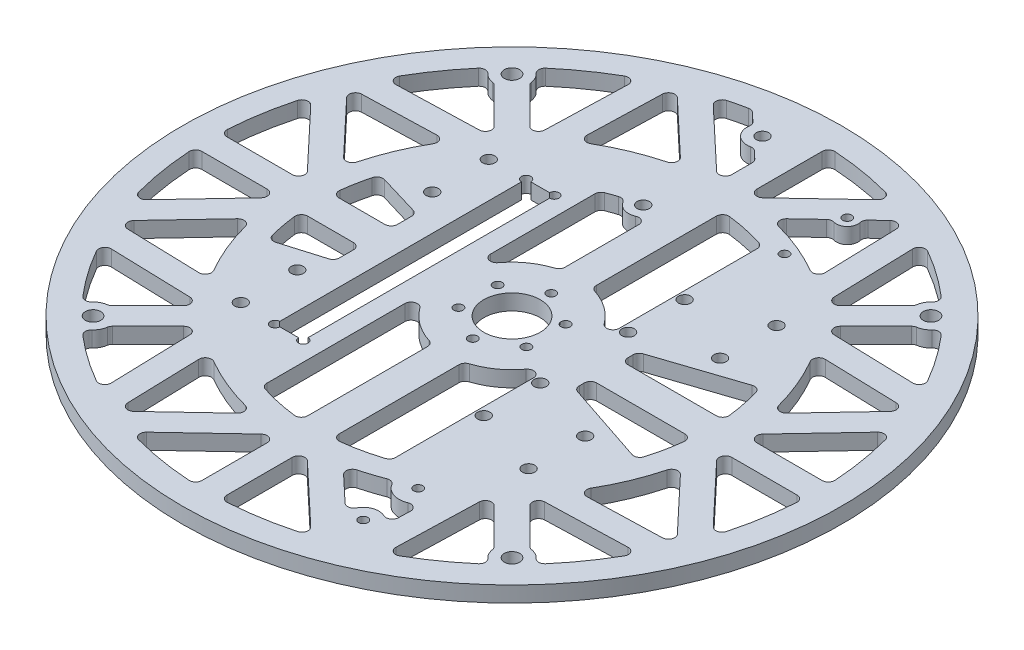
from build123d import *

# Parameters (mm, degrees)
SKETCH_1_R          = 105
EXTRUDE_1_DEPTH     = 5
SKETCH_3_R          = 1.95
SKETCH_3_R_2        = 1.45
CUT_EXTRUDE_1_DEPTH = 149.576579581
SKETCH_6_W          = 9
SKETCH_6_H          = 80
CUT_EXTRUDE_2_DEPTH = 149.576579581
SKETCH_7_R          = 2.45
CUT_EXTRUDE_3_DEPTH = 149.576579581
SKETCH_8_R          = 1.45
CUT_EXTRUDE_4_DEPTH = 149.576579581
SKETCH_10_R         = 9
CUT_EXTRUDE_5_DEPTH = 149.576579581
CUT_EXTRUDE_7_DEPTH = 149.576579581
FILLET_3_R          = 2
SKETCH_11_R         = 1.5
CUT_EXTRUDE_8_DEPTH = 149.576579726


with BuildPart() as part:
    # 草图1 → 凸台-拉伸1 (new body)
    with BuildSketch(Plane(origin=(0, 0, 0), x_dir=(1, 0, 0), z_dir=(0, 1, 0))):
        with Locations(Location((0, 0, 0), (0, 0, 270))):
            Circle(SKETCH_1_R)
    extrude(amount=EXTRUDE_1_DEPTH)

    # 草图3 → 切除-拉伸1 (cut, through all)
    with BuildSketch(Plane(origin=(0, 5, 0), x_dir=(1, 0, 0), z_dir=(0, 1, 0))):
        with Locations(Location((-46.9, -39.5, 0), (0, 0, 270))):
            Circle(SKETCH_3_R)
        with Locations(Location((-46.9, -21.5, 0), (0, 0, 270))):
            Circle(SKETCH_3_R)
        with Locations(Location((-46.9, 21.5, 0), (0, 0, 270))):
            Circle(SKETCH_3_R)
        with Locations(Location((-46.9, 39.5, 0), (0, 0, 270))):
            Circle(SKETCH_3_R)
        with Locations(Location((23, -32, 0), (0, 0, 270))):
            Circle(SKETCH_3_R)
        with Locations(Location((23, -14, 0), (0, 0, 270))):
            Circle(SKETCH_3_R)
        with Locations(Location((44.8, -39.5, 0), (0, 0, 270))):
            Circle(SKETCH_3_R)
        with Locations(Location((44.8, -21.5, 0), (0, 0, 270))):
            Circle(SKETCH_3_R)
        with Locations(Location((44.8, 39.5, 0), (0, 0, 270))):
            Circle(SKETCH_3_R)
        with Locations(Location((44.8, 21.5, 0), (0, 0, 270))):
            Circle(SKETCH_3_R)
        with Locations(Location((23, 32, 0), (0, 0, 270))):
            Circle(SKETCH_3_R)
        with Locations(Location((23, 14, 0), (0, 0, 270))):
            Circle(SKETCH_3_R)
        with Locations(Location((-9.7, 89.515955641, 0), (0, 0, 270))):
            Circle(SKETCH_3_R)
        with Locations(Location((-9.7, 51.515955641, 0), (0, 0, 270))):
            Circle(SKETCH_3_R)
        with Locations(Location((26.3, 80.515955641, 0), (0, 0, 270))):
            Circle(SKETCH_3_R_2)
        with Locations(Location((32.6, -62.5, 0), (0, 0, 270))):
            Circle(SKETCH_3_R_2)
        with Locations(Location((32.6, -80, 0), (0, 0, 270))):
            Circle(SKETCH_3_R_2)
        with Locations(Location((26.3, 60.515955641, 0), (0, 0, 270))):
            Circle(SKETCH_3_R_2)
    extrude(amount=-CUT_EXTRUDE_1_DEPTH, mode=Mode.SUBTRACT)

    # 草图6 → 切除-拉伸2 (cut, through all)
    with BuildSketch(Plane.XZ):
        with Locations((-31, 0)):
            Rectangle(SKETCH_6_W, SKETCH_6_H)
    extrude(amount=-CUT_EXTRUDE_2_DEPTH, mode=Mode.SUBTRACT)

    # 草图7 → 切除-拉伸3 (cut, through all)
    with BuildSketch(Plane(origin=(0, 5, 0), x_dir=(1, 0, 0), z_dir=(0, 1, 0))):
        with Locations(Location((66.740273542, 66.740273542, 0), (0, 0, 270))):
            Circle(SKETCH_7_R)
        with Locations(Location((-66.740273542, 66.740273542, 0), (0, 0, 270))):
            Circle(SKETCH_7_R)
        with Locations(Location((-66.740273542, -66.740273542, 0), (0, 0, 270))):
            Circle(SKETCH_7_R)
        with Locations(Location((66.740273542, -66.740273542, 0), (0, 0, 270))):
            Circle(SKETCH_7_R)
    extrude(amount=-CUT_EXTRUDE_3_DEPTH, mode=Mode.SUBTRACT)

    # 草图8 → 切除-拉伸4 (cut, through all)
    with BuildSketch(Plane(origin=(0, 5, 0), x_dir=(1, 0, 0), z_dir=(0, 1, 0))):
        with Locations(Location((0, 12.5, 0), (0, 0, 270))):
            Circle(SKETCH_8_R)
        with Locations(Location((10.825317547, 6.25, 0), (0, 0, 270))):
            Circle(SKETCH_8_R)
        with Locations(Location((10.825317547, -6.25, 0), (0, 0, 270))):
            Circle(SKETCH_8_R)
        with Locations(Location((0, -12.5, 0), (0, 0, 270))):
            Circle(SKETCH_8_R)
        with Locations(Location((-10.825317547, -6.25, 0), (0, 0, 270))):
            Circle(SKETCH_8_R)
        with Locations(Location((-10.825317547, 6.25, 0), (0, 0, 270))):
            Circle(SKETCH_8_R)
    extrude(amount=-CUT_EXTRUDE_4_DEPTH, mode=Mode.SUBTRACT)

    # 草图10 → 切除-拉伸5 (cut, through all)
    with BuildSketch(Plane.XZ):
        with Locations(Location((0, 0, 0), (0, 0, 270))):
            Circle(SKETCH_10_R)
    extrude(amount=-CUT_EXTRUDE_5_DEPTH, mode=Mode.SUBTRACT)

    # 草图9 → 切除-拉伸7 (cut, through all)
    with BuildSketch(Plane.XZ):
        with BuildLine():
            Line((-96.917490682, 4), (-69.384796606, 4))
            Line((-69.384796606, 4), (-92.660792351, 28.687585484))
            ThreePointArc((-92.660792351, 28.687585484), (-95.589489844, 16.481790903), (-96.917490682, 4))
        make_face()
        with BuildLine():
            Line((-68.028931884, 14.223727596), (-89.616314654, 37.120292939))
            Line((-89.616314654, 37.120292939), (-58.161413289, 38.046024815))
            ThreePointArc((-58.161413289, 38.046024815), (-64.20962751, 26.596498549), (-68.028931884, 14.223727596))
        make_face()
        with BuildLine():
            Line((-85.806260853, 45.23588839), (-51.890887316, 46.234033066))
            Line((-51.890887316, 46.234033066), (-66.951211412, 61.294357163))
            ThreePointArc((-66.951211412, 61.294357163), (-70.037232101, 62.400623296), (-71.930303966, 65.077118647))
            ThreePointArc((-71.930303966, 65.077118647), (-79.489776542, 55.591145205), (-85.806260853, 45.23588839))
        make_face()
        with BuildLine():
            Line((-28.687585484, 92.660792351), (-4, 69.384796606))
            Line((-4, 69.384796606), (-4, 96.917490682))
            ThreePointArc((-4, 96.917490682), (-16.481790903, 95.589489844), (-28.687585484, 92.660792351))
        make_face()
        with BuildLine():
            Line((-38.046024815, 58.161413289), (-37.120292939, 89.616314654))
            Line((-37.120292939, 89.616314654), (-14.223727596, 68.028931884))
            ThreePointArc((-14.223727596, 68.028931884), (-26.596498549, 64.20962751), (-38.046024815, 58.161413289))
        make_face()
        with BuildLine():
            Line((-61.294357163, 66.951211412), (-46.234033066, 51.890887316))
            Line((-46.234033066, 51.890887316), (-45.23588839, 85.806260853))
            ThreePointArc((-45.23588839, 85.806260853), (-55.591145205, 79.489776542), (-65.077118647, 71.930303966))
            ThreePointArc((-65.077118647, 71.930303966), (-62.400623296, 70.037232101), (-61.294357163, 66.951211412))
        make_face()
        with BuildLine():
            Line((45.23588839, 85.806260853), (46.234033066, 51.890887316))
            Line((46.234033066, 51.890887316), (61.294357163, 66.951211412))
            ThreePointArc((61.294357163, 66.951211412), (62.400623296, 70.037232101), (65.077118647, 71.930303966))
            ThreePointArc((65.077118647, 71.930303966), (55.591145205, 79.489776542), (45.23588839, 85.806260853))
        make_face()
        with BuildLine():
            Line((14.223727596, 68.028931884), (27.705618691, 80.739953784))
            ThreePointArc((27.705618691, 80.739953784), (31.698178556, 75.132842916), (37.434581063, 78.937302516))
            Line((37.434581063, 78.937302516), (37.825729314, 65.646705124))
            ThreePointArc((37.825729314, 65.646705124), (31.787163111, 68.545601392), (26.728717013, 64.154701206))
            ThreePointArc((26.728717013, 64.154701206), (20.56764682, 66.38691064), (14.223727596, 68.028931884))
        make_face()
        with BuildLine():
            Line((4, 96.917490682), (4, 69.384796606))
            Line((4, 69.384796606), (28.687585484, 92.660792351))
            ThreePointArc((28.687585484, 92.660792351), (16.481790903, 95.589489844), (4, 96.917490682))
        make_face()
        with BuildLine():
            Line((92.660792351, 28.687585484), (69.384796606, 4))
            Line((69.384796606, 4), (96.917490682, 4))
            ThreePointArc((96.917490682, 4), (95.589489844, 16.481790903), (92.660792351, 28.687585484))
        make_face()
        with BuildLine():
            Line((58.161413289, 38.046024815), (89.616314654, 37.120292939))
            Line((89.616314654, 37.120292939), (68.028931884, 14.223727596))
            ThreePointArc((68.028931884, 14.223727596), (64.20962751, 26.596498549), (58.161413289, 38.046024815))
        make_face()
        with BuildLine():
            Line((66.951211412, 61.294357163), (51.890887316, 46.234033066))
            Line((51.890887316, 46.234033066), (85.806260853, 45.23588839))
            ThreePointArc((85.806260853, 45.23588839), (79.489776542, 55.591145205), (71.930303966, 65.077118647))
            ThreePointArc((71.930303966, 65.077118647), (70.037232101, 62.400623296), (66.951211412, 61.294357163))
        make_face()
        with BuildLine():
            Line((85.806260853, -45.23588839), (51.890887316, -46.234033066))
            Line((51.890887316, -46.234033066), (66.951211412, -61.294357163))
            ThreePointArc((66.951211412, -61.294357163), (70.037232101, -62.400623296), (71.930303966, -65.077118647))
            ThreePointArc((71.930303966, -65.077118647), (79.489776542, -55.591145205), (85.806260853, -45.23588839))
        make_face()
        with BuildLine():
            Line((68.028931884, -14.223727596), (89.616314654, -37.120292939))
            Line((89.616314654, -37.120292939), (58.161413289, -38.046024815))
            ThreePointArc((58.161413289, -38.046024815), (64.20962751, -26.596498549), (68.028931884, -14.223727596))
        make_face()
        with BuildLine():
            Line((96.917490682, -4), (69.384796606, -4))
            Line((69.384796606, -4), (92.660792351, -28.687585484))
            ThreePointArc((92.660792351, -28.687585484), (95.589489844, -16.481790903), (96.917490682, -4))
        make_face()
        with BuildLine():
            Line((28.687585484, -92.660792351), (4, -69.384796606))
            Line((4, -69.384796606), (4, -96.917490682))
            ThreePointArc((4, -96.917490682), (16.481790903, -95.589489844), (28.687585484, -92.660792351))
        make_face()
        with BuildLine():
            Line((38.046024815, -58.161413289), (37.120292939, -89.616314654))
            Line((37.120292939, -89.616314654), (29.291258588, -82.234929772))
            ThreePointArc((29.291258588, -82.234929772), (28.666697536, -78.005728007), (24.408085278, -77.630967134))
            Line((24.408085278, -77.630967134), (14.223727596, -68.028931884))
            ThreePointArc((14.223727596, -68.028931884), (26.596498549, -64.20962751), (38.046024815, -58.161413289))
        make_face()
        with BuildLine():
            Line((61.294357163, -66.951211412), (46.234033066, -51.890887316))
            Line((46.234033066, -51.890887316), (45.23588839, -85.806260853))
            ThreePointArc((45.23588839, -85.806260853), (55.591145205, -79.489776542), (65.077118647, -71.930303966))
            ThreePointArc((65.077118647, -71.930303966), (62.400623296, -70.037232101), (61.294357163, -66.951211412))
        make_face()
        with BuildLine():
            Line((-45.23588839, -85.806260853), (-46.234033066, -51.890887316))
            Line((-46.234033066, -51.890887316), (-61.294357163, -66.951211412))
            ThreePointArc((-61.294357163, -66.951211412), (-62.400623296, -70.037232101), (-65.077118647, -71.930303966))
            ThreePointArc((-65.077118647, -71.930303966), (-55.591145205, -79.489776542), (-45.23588839, -85.806260853))
        make_face()
        with BuildLine():
            Line((-14.223727596, -68.028931884), (-37.120292939, -89.616314654))
            Line((-37.120292939, -89.616314654), (-38.046024815, -58.161413289))
            ThreePointArc((-38.046024815, -58.161413289), (-26.596498549, -64.20962751), (-14.223727596, -68.028931884))
        make_face()
        with BuildLine():
            Line((-4, -69.384796606), (-28.687585484, -92.660792351))
            ThreePointArc((-28.687585484, -92.660792351), (-23.695945652, -94.061161803), (-18.636616602, -95.192838605))
            Line((-18.636616602, -95.192838605), (-14.366558573, -91.166934468))
            ThreePointArc((-14.366558573, -91.166934468), (-13.095696464, -85.914324688), (-7.77743857, -84.954567963))
            Line((-7.77743857, -84.954567963), (-4, -81.393116231))
            Line((-4, -81.393116231), (-4, -69.384796606))
        make_face()
        with BuildLine():
            Line((-92.660792351, -28.687585484), (-69.384796606, -4))
            Line((-69.384796606, -4), (-96.917490682, -4))
            ThreePointArc((-96.917490682, -4), (-95.589489844, -16.481790903), (-92.660792351, -28.687585484))
        make_face()
        with BuildLine():
            Line((-58.161413289, -38.046024815), (-89.616314654, -37.120292939))
            Line((-89.616314654, -37.120292939), (-68.028931884, -14.223727596))
            ThreePointArc((-68.028931884, -14.223727596), (-64.20962751, -26.596498549), (-58.161413289, -38.046024815))
        make_face()
        with BuildLine():
            Line((-66.951211412, -61.294357163), (-51.890887316, -46.234033066))
            Line((-51.890887316, -46.234033066), (-85.806260853, -45.23588839))
            ThreePointArc((-85.806260853, -45.23588839), (-79.489776542, -55.591145205), (-71.930303966, -65.077118647))
            ThreePointArc((-71.930303966, -65.077118647), (-70.037232101, -62.400623296), (-66.951211412, -61.294357163))
        make_face()
        with BuildLine():
            Line((-62.299678972, 5), (-43.5, 5))
            Line((-43.5, 5), (-43.5, 13))
            Line((-43.5, 13), (-59.883053859, 17.896085061))
            ThreePointArc((-59.883053859, 17.896085061), (-61.430711399, 11.511633117), (-62.299678972, 5))
        make_face()
        with BuildLine():
            Line((-20.5, 59.042357677), (-20.5, 4.55521679))
            ThreePointArc((-20.5, 4.55521679), (-15.009854143, 14.686874364), (-5, 20.396078054))
            Line((-5, 20.396078054), (-5, 62.299678972))
            ThreePointArc((-5, 62.299678972), (-12.853600099, 61.16400056), (-20.5, 59.042357677))
        make_face()
        with BuildLine():
            Line((20.5, 59.042357677), (20.5, 4.55521679))
            ThreePointArc((20.5, 4.55521679), (15.009854143, 14.686874364), (5, 20.396078054))
            Line((5, 20.396078054), (5, 62.299678972))
            ThreePointArc((5, 62.299678972), (12.853600099, 61.16400056), (20.5, 59.042357677))
        make_face()
        with BuildLine():
            Line((20.5, -59.042357677), (20.5, -4.55521679))
            ThreePointArc((20.5, -4.55521679), (15.009854143, -14.686874364), (5, -20.396078054))
            Line((5, -20.396078054), (5, -62.299678972))
            ThreePointArc((5, -62.299678972), (12.853600099, -61.16400056), (20.5, -59.042357677))
        make_face()
        with BuildLine():
            Line((-20.5, -48.246592477), (-20.5, -4.55521679))
            ThreePointArc((-20.5, -4.55521679), (-15.009854143, -14.686874364), (-5, -20.396078054))
            Line((-5, -20.396078054), (-5, -51.515955641))
            ThreePointArc((-5, -51.515955641), (-9.158458033, -46.847258575), (-14.275205233, -50.440085261))
            ThreePointArc((-14.275205233, -50.440085261), (-17.422157656, -49.441400751), (-20.5, -48.246592477))
        make_face()
        with BuildLine():
            Line((-43.5, -5), (-43.5, -13))
            Line((-43.5, -13), (-59.883053859, -17.896085061))
            ThreePointArc((-59.883053859, -17.896085061), (-61.430711399, -11.511633117), (-62.299678972, -5))
            Line((-62.299678972, -5), (-43.5, -5))
        make_face()
        with BuildLine():
            Line((30, 5), (62.299678972, 5))
            ThreePointArc((62.299678972, 5), (61.242735815, 12.473063371), (59.292706128, 19.764235376))
            Line((59.292706128, 19.764235376), (30, 10))
            Line((30, 10), (30, 5))
        make_face()
        with BuildLine():
            Line((30, -10), (59.292706128, -19.764235376))
            ThreePointArc((59.292706128, -19.764235376), (61.242735815, -12.473063371), (62.299678972, -5))
            Line((62.299678972, -5), (30, -5))
            Line((30, -5), (30, -10))
        make_face()
    extrude(amount=-CUT_EXTRUDE_7_DEPTH, mode=Mode.SUBTRACT)

    # 圆角3
    fillet_3_edges = [part.edges().sort_by_distance(p)[0] for p in [
        (92.660792351, 2.5, 28.687585484),
        (96.917490682, 2.5, 4),
        (69.384796606, 2.5, 4),
        (4, 2.5, 96.917490682),
        (28.687585484, 2.5, 92.660792351),
        (4, 2.5, 69.384796606),
        (61.294357163, 2.5, 66.951211412),
        (46.234033066, 2.5, 51.890887316),
        (45.23588839, 2.5, 85.806260853),
        (65.077118647, 2.5, 71.930303966),
        (71.930303966, 2.5, -65.077118647),
        (66.951211412, 2.5, -61.294357163),
        (51.890887316, 2.5, -46.234033066),
        (85.806260853, 2.5, -45.23588839),
        (89.616314654, 2.5, 37.120292939),
        (68.028931884, 2.5, 14.223727596),
        (58.161413289, 2.5, 38.046024815),
        (71.930303966, 2.5, 65.077118647),
        (85.806260853, 2.5, 45.23588839),
        (51.890887316, 2.5, 46.234033066),
        (66.951211412, 2.5, 61.294357163),
        (61.294357163, 2.5, -66.951211412),
        (65.077118647, 2.5, -71.930303966),
        (45.23588839, 2.5, -85.806260853),
        (46.234033066, 2.5, -51.890887316),
        (29.291258588, 2.5, -82.234929772),
        (24.408085278, 2.5, -77.630967134),
        (14.223727596, 2.5, -68.028931884),
        (38.046024815, 2.5, -58.161413289),
        (37.120292939, 2.5, -89.616314654),
        (-89.616314654, 2.5, 37.120292939),
        (-58.161413289, 2.5, 38.046024815),
        (-68.028931884, 2.5, 14.223727596),
        (-66.951211412, 2.5, 61.294357163),
        (-51.890887316, 2.5, 46.234033066),
        (-85.806260853, 2.5, 45.23588839),
        (-71.930303966, 2.5, 65.077118647),
        (-62.299678972, 2.5, 5),
        (-59.883053859, 2.5, 17.896085061),
        (-43.5, 2.5, 13),
        (-43.5, 2.5, 5),
        (37.825729314, 2.5, 65.646705124),
        (26.728717013, 2.5, 64.154701206),
        (14.223727596, 2.5, 68.028931884),
        (27.705618691, 2.5, 80.739953784),
        (37.434581063, 2.5, 78.937302516),
        (-65.077118647, 2.5, 71.930303966),
        (-45.23588839, 2.5, 85.806260853),
        (-46.234033066, 2.5, 51.890887316),
        (-61.294357163, 2.5, 66.951211412),
        (-37.120292939, 2.5, 89.616314654),
        (-14.223727596, 2.5, 68.028931884),
        (-38.046024815, 2.5, 58.161413289),
        (-28.687585484, 2.5, 92.660792351),
        (-4, 2.5, 96.917490682),
        (-4, 2.5, 69.384796606),
        (-96.917490682, 2.5, 4),
        (-92.660792351, 2.5, 28.687585484),
        (-69.384796606, 2.5, 4),
        (-71.930303966, 2.5, -65.077118647),
        (-85.806260853, 2.5, -45.23588839),
        (-51.890887316, 2.5, -46.234033066),
        (-66.951211412, 2.5, -61.294357163),
        (-5, 2.5, -51.515955641),
        (-14.275205233, 2.5, -50.440085261),
        (-20.5, 2.5, -48.246592477),
        (-20.5, 2.5, -4.55521679),
        (-5, 2.5, -20.396078054),
        (5, 2.5, 62.299678972),
        (20.5, 2.5, 59.042357677),
        (20.5, 2.5, 4.55521679),
        (5, 2.5, 20.396078054),
        (20.5, 2.5, -59.042357677),
        (5, 2.5, -62.299678972),
        (5, 2.5, -20.396078054),
        (20.5, 2.5, -4.55521679),
        (30, 2.5, -10),
        (30, 2.5, -5),
        (62.299678972, 2.5, -5),
        (59.292706128, 2.5, -19.764235376),
        (30, 2.5, 5),
        (30, 2.5, 10),
        (59.292706128, 2.5, 19.764235376),
        (62.299678972, 2.5, 5),
        (-62.299678972, 2.5, -5),
        (-43.5, 2.5, -5),
        (-43.5, 2.5, -13),
        (-59.883053859, 2.5, -17.896085061),
        (96.917490682, 2.5, -4),
        (92.660792351, 2.5, -28.687585484),
        (69.384796606, 2.5, -4),
        (89.616314654, 2.5, -37.120292939),
        (58.161413289, 2.5, -38.046024815),
        (68.028931884, 2.5, -14.223727596),
        (28.687585484, 2.5, -92.660792351),
        (4, 2.5, -96.917490682),
        (4, 2.5, -69.384796606),
        (-61.294357163, 2.5, -66.951211412),
        (-46.234033066, 2.5, -51.890887316),
        (-45.23588839, 2.5, -85.806260853),
        (-65.077118647, 2.5, -71.930303966),
        (-18.636616602, 2.5, -95.192838605),
        (-28.687585484, 2.5, -92.660792351),
        (-4, 2.5, -69.384796606),
        (-4, 2.5, -81.393116231),
        (-7.77743857, 2.5, -84.954567963),
        (-14.366558573, 2.5, -91.166934468),
        (-37.120292939, 2.5, -89.616314654),
        (-38.046024815, 2.5, -58.161413289),
        (-14.223727596, 2.5, -68.028931884),
        (-89.616314654, 2.5, -37.120292939),
        (-68.028931884, 2.5, -14.223727596),
        (-58.161413289, 2.5, -38.046024815),
        (-92.660792351, 2.5, -28.687585484),
        (-96.917490682, 2.5, -4),
        (-69.384796606, 2.5, -4),
        (-5, 2.5, 20.396078054),
        (-20.5, 2.5, 4.55521679),
        (-20.5, 2.5, 59.042357677),
        (-5, 2.5, 62.299678972),
    ]]
    fillet(fillet_3_edges, radius=FILLET_3_R)

    # 草图11 → 切除-拉伸8 (cut, through all)
    with BuildSketch(Plane.XZ):
        with Locations((-35.5, 40)):
            Circle(SKETCH_11_R)
        with Locations((-26.5, 40)):
            Circle(SKETCH_11_R)
        with Locations((-35.5, -40)):
            Circle(SKETCH_11_R)
        with Locations((-26.5, -40)):
            Circle(SKETCH_11_R)
    extrude(amount=-CUT_EXTRUDE_8_DEPTH, mode=Mode.SUBTRACT)


solid = part.part
